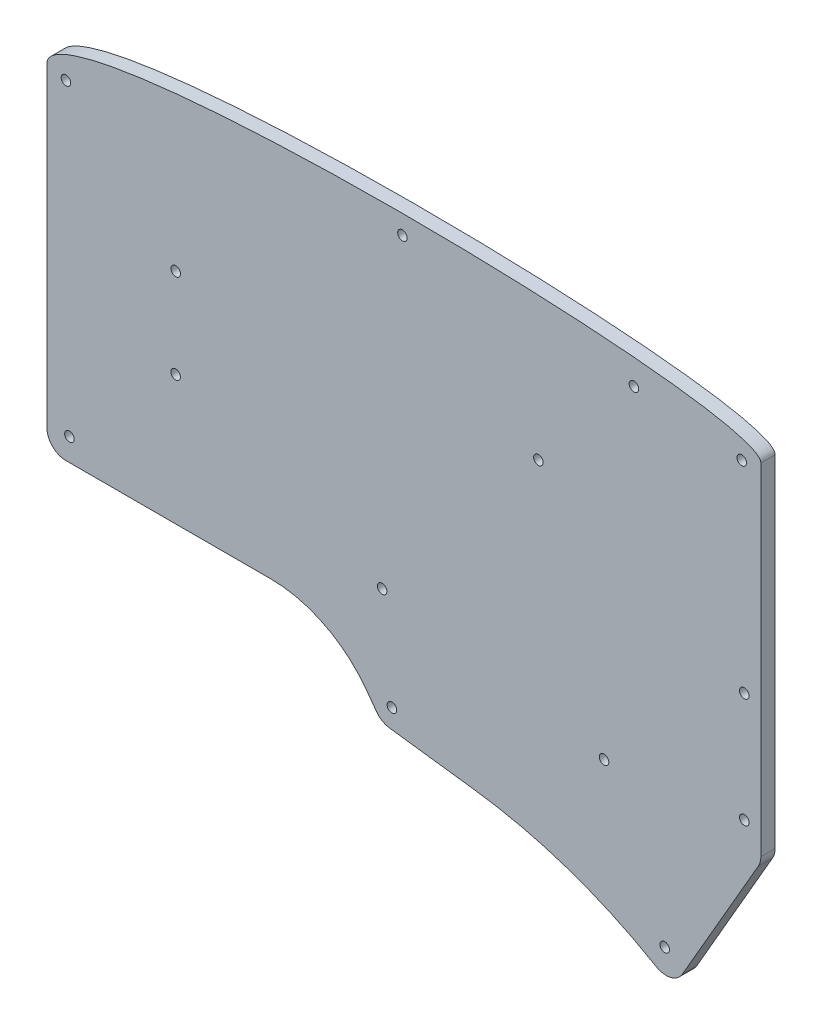
from build123d import *

# Parameters (mm, degrees)
SKETCH2_R           = 1
BOSS_EXTRUDE1_DEPTH = 3


with BuildPart() as part:
    # Sketch2 → Boss-Extrude1 (new body)
    with BuildSketch(Plane.XY):
        with BuildLine():
            add(Edge.make_bspline(
                [(-5.603408365, 96.42556159), (-5.603408365, 103.460733083), (68.627157279, 109.640132521), (143.989385396, 103.458567417), (143.989385396, 98.790469349)],
                knots=[0, 0, 0, 0, 0.499912399, 1, 1, 1, 1], degree=3))
            Line((-5.603408365, 96.42556159), (-5.603408365, 30.425568858))
            ThreePointArc((-5.603408365, 30.425568858), (-4.43183549, 27.597141733), (-1.603408365, 26.425568858))
            Line((-1.603408365, 26.425568858), (41.26721418, 26.425568858))
            ThreePointArc((41.26721418, 26.425568858), (52.597121833, 23.710837368), (61.46641692, 16.156224264))
            Line((61.46641692, 16.156224264), (63.465114175, 13.41553894))
            ThreePointArc((63.465114175, 13.41553894), (64.657533725, 12.331421876), (66.181004174, 11.805863146))
            Line((66.181004174, 11.805863146), (84.187939735, 9.463477264))
            ThreePointArc((84.187939735, 9.463477264), (103.379739296, 5.009808001), (121.325879515, -3.120160731))
            Line((121.325879515, -3.120160731), (122.126093986, -3.582626958))
            ThreePointArc((122.126093986, -3.582626958), (125.162033535, -3.98331921), (127.591695632, -2.119391819))
            Line((127.591695632, -2.119391819), (143.453487011, 25.354036748))
            ThreePointArc((143.453487011, 25.354036748), (143.853088701, 26.318760568), (143.989385396, 27.354036748))
            Line((143.989385396, 27.354036748), (143.989385396, 98.790469349))
        make_face()
        with Locations((66.696986614, 15.772443805)):
            Circle(SKETCH2_R, mode=Mode.SUBTRACT)
        with Locations((-0.871175318, 31.157801905)):
            Circle(SKETCH2_R, mode=Mode.SUBTRACT)
        with Locations((64.637863533, 36.300090173)):
            Circle(SKETCH2_R, mode=Mode.SUBTRACT)
        with Locations((123.859596668, 0.88165491)):
            Circle(SKETCH2_R, mode=Mode.SUBTRACT)
        with Locations((111.137845658, 28.550051811)):
            Circle(SKETCH2_R, mode=Mode.SUBTRACT)
        with Locations((140.524945013, 32.281066453)):
            Circle(SKETCH2_R, mode=Mode.SUBTRACT)
        with Locations((21.387798276, 53.550235091)):
            Circle(SKETCH2_R, mode=Mode.SUBTRACT)
        with Locations((21.387798276, 72.300241098)):
            Circle(SKETCH2_R, mode=Mode.SUBTRACT)
        with Locations((-1.603408365, 95.42556159)):
            Circle(SKETCH2_R, mode=Mode.SUBTRACT)
        with Locations((68.896968427, 102.54989148)):
            Circle(SKETCH2_R, mode=Mode.SUBTRACT)
        with Locations((97.387827206, 76.050038887)):
            Circle(SKETCH2_R, mode=Mode.SUBTRACT)
        with Locations((140.524945013, 55.281066453)):
            Circle(SKETCH2_R, mode=Mode.SUBTRACT)
        with Locations((117.399952063, 99.390469349)):
            Circle(SKETCH2_R, mode=Mode.SUBTRACT)
        with Locations((139.989385396, 97.290469349)):
            Circle(SKETCH2_R, mode=Mode.SUBTRACT)
    extrude(amount=BOSS_EXTRUDE1_DEPTH)


solid = part.part
